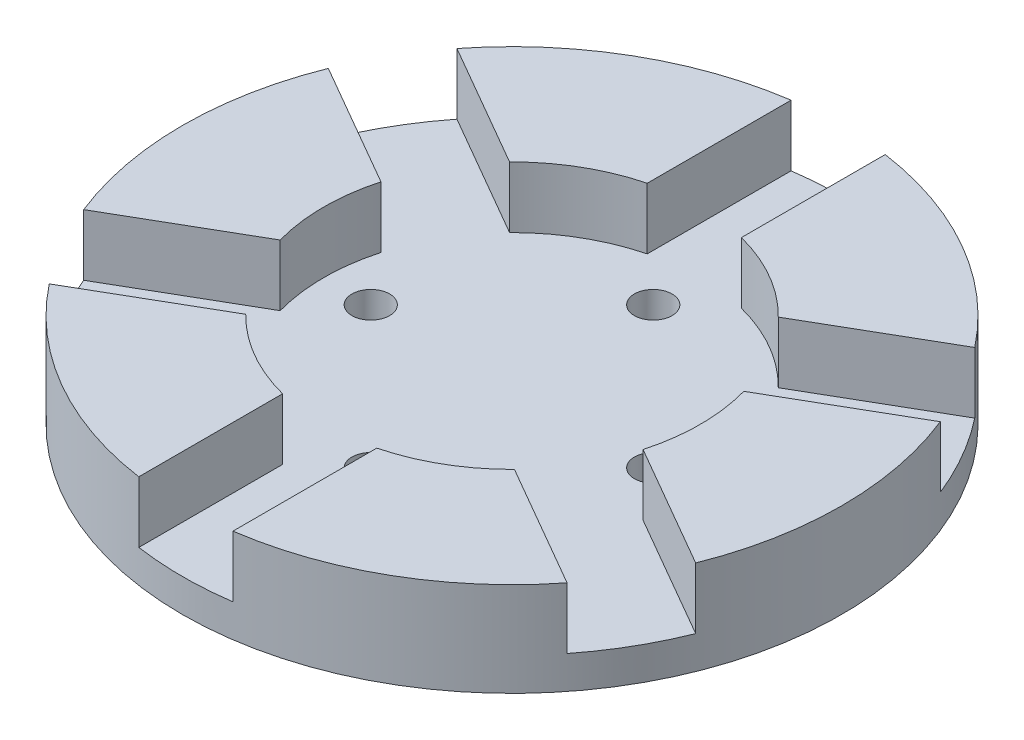
from build123d import *

# Parameters (mm, degrees)
SKETCH1_R           = 35
BOSS_EXTRUDE1_DEPTH = 10
CUT_EXTRUDE1_REACH  = 52.498
SKETCH2_R           = 2
CIRPATTERN1_COUNT   = 4
SKETCH5_W           = 10
SKETCH5_H           = 16.60119737
CUT_EXTRUDE2_DEPTH  = 51.497524692
CIRPATTERN2_COUNT   = 3
SKETCH6_R           = 20
CUT_EXTRUDE3_DEPTH  = 6.5


with BuildPart() as part:
    # Sketch1 → Boss-Extrude1 (new body)
    with BuildSketch(Plane(origin=(0, 0, 0), x_dir=(1, 0, 0), z_dir=(0, 1, 0))):
        with Locations(Location((0, 0, 0), (0, 0, 270))):
            Circle(SKETCH1_R)
    extrude(amount=BOSS_EXTRUDE1_DEPTH)

    # Sketch2 → Cut-Extrude1 (cut, up to next)
    with BuildSketch(Plane(origin=(0, 10, 0), x_dir=(1, 0, 0), z_dir=(0, 1, 0)), mode=Mode.PRIVATE) as cut_extrude1_sk1:
        with Locations(Location((0, 15, 0), (0, 0, 270))):
            Circle(SKETCH2_R)
    cut_extrude1_tool1 = extrude(cut_extrude1_sk1.sketch, amount=-CUT_EXTRUDE1_REACH, mode=Mode.PRIVATE) & part.part
    cut_extrude1 = cut_extrude1_tool1.solids().sort_by_distance((0, 10, -15))[0]
    add(cut_extrude1, mode=Mode.SUBTRACT)

    # CirPattern1: Cut-Extrude1 ×4 about axis
    cirpattern1_axis = Axis((0, 0, 0), (0, 1, 0))
    for i in range(1, CIRPATTERN1_COUNT):
        add(cut_extrude1.rotate(cirpattern1_axis, i * 360 / CIRPATTERN1_COUNT), mode=Mode.SUBTRACT)

    # Sketch5 → Cut-Extrude2 (cut, symmetric)
    with BuildSketch(Plane.XY):
        with Locations((0, 11.800598685)):
            Rectangle(SKETCH5_W, SKETCH5_H)
    cut_extrude2 = extrude(amount=CUT_EXTRUDE2_DEPTH, both=True, mode=Mode.SUBTRACT)

    # CirPattern2: Cut-Extrude2 ×3 about axis
    cirpattern2_axis = Axis((0, 0, 0), (0, 1, 0))
    for i in range(1, CIRPATTERN2_COUNT):
        add(cut_extrude2.rotate(cirpattern2_axis, i * 360 / CIRPATTERN2_COUNT), mode=Mode.SUBTRACT)

    # Sketch6 → Cut-Extrude3 (cut)
    with BuildSketch(Plane(origin=(0, 10, 0), x_dir=(1, 0, 0), z_dir=(0, 1, 0))):
        Circle(SKETCH6_R)
    extrude(amount=-CUT_EXTRUDE3_DEPTH, mode=Mode.SUBTRACT)


solid = part.part
